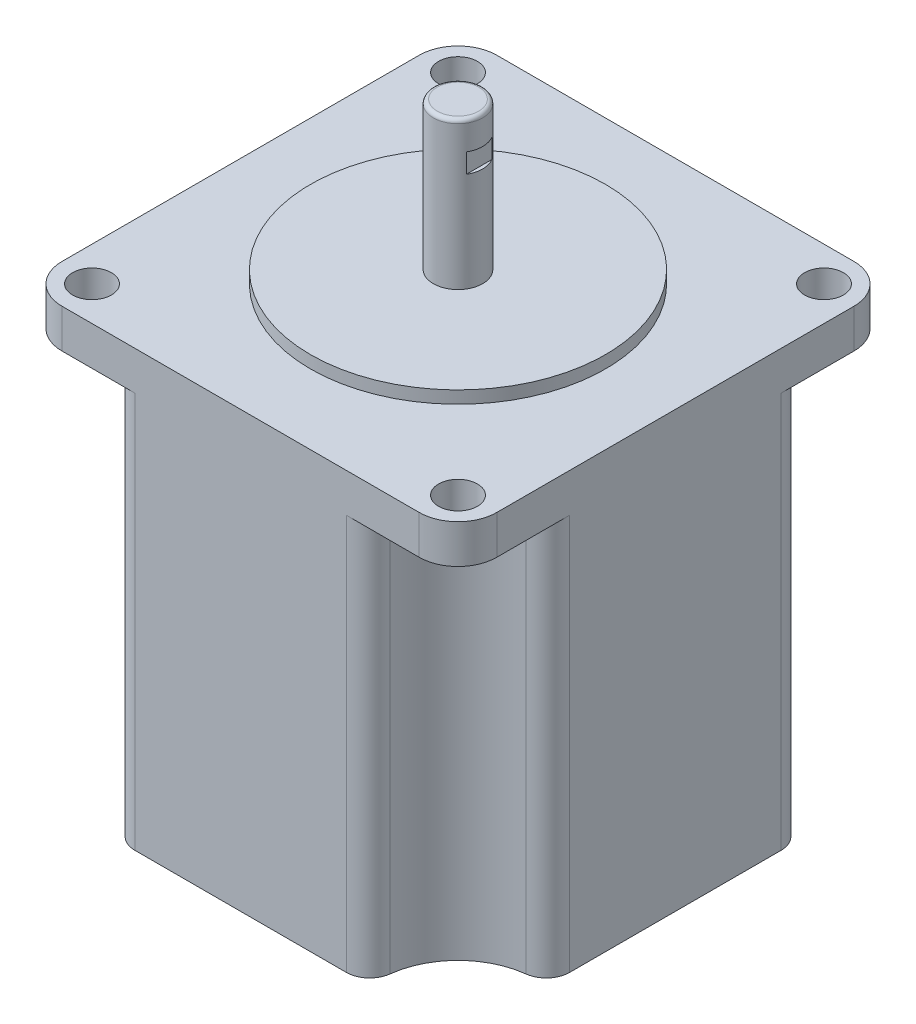
from build123d import *

# Parameters (mm, degrees)
EXTRUDE1_DEPTH      = 56
SKETCH2_R           = 2.5
EXTRUDE2_DEPTH      = 69.585712798
SKETCH4_R           = 10
EXTRUDE3_DEPTH      = 51
FILLET1_R           = 3
SKETCH5_R           = 19
EXTRUDE4_DEPTH      = 1.6
SKETCH6_R           = 3.175
EXTRUDE5_DEPTH      = 20.6
FILLET2_R           = 0.5
SKETCH_1_W          = 0.754278007
SKETCH_1_H          = 3.431599036
CUT_EXTRUDE_1_DEPTH = 2.5


with BuildPart() as part:
    # Sketch1 → Extrude1 (new body)
    with BuildSketch(Plane(origin=(0, 0, 0), x_dir=(1, 0, 0), z_dir=(0, 1, 0))):
        with BuildLine():
            Line((-23, 28), (23, 28))
            ThreePointArc((23, 28), (26.535533906, 26.535533906), (28, 23))
            Line((28, 23), (28, -23))
            ThreePointArc((28, -23), (26.535533906, -26.535533906), (23, -28))
            Line((23, -28), (-23, -28))
            ThreePointArc((-23, -28), (-26.535533906, -26.535533906), (-28, -23))
            Line((-28, -23), (-28, 23))
            ThreePointArc((-28, 23), (-26.535533906, 26.535533906), (-23, 28))
        make_face()
    extrude(amount=EXTRUDE1_DEPTH)

    # Sketch2 → Extrude2 (cut, through all)
    with BuildSketch(Plane.XZ):
        with Locations(Location((23.57, 23.57, 0), (0, 0, 90))):
            Circle(SKETCH2_R)
        with Locations(Location((23.57, -23.57, 0), (0, 0, 270))):
            Circle(SKETCH2_R)
        with Locations(Location((-23.57, -23.57, 0), (0, 0, 90))):
            Circle(SKETCH2_R)
        with Locations(Location((-23.57, 23.57, 0), (0, 0, 270))):
            Circle(SKETCH2_R)
    extrude(amount=-EXTRUDE2_DEPTH, mode=Mode.SUBTRACT)

    # Sketch4 → Extrude3 (cut)
    with BuildSketch(Plane.XZ):
        with Locations((-26.535533906, 26.535533906)):
            Circle(SKETCH4_R)
        with Locations((26.535533906, 26.535533906)):
            Circle(SKETCH4_R)
        with Locations((26.535533906, -26.535533906)):
            Circle(SKETCH4_R)
        with Locations((-26.535533906, -26.535533906)):
            Circle(SKETCH4_R)
    extrude(amount=-EXTRUDE3_DEPTH, mode=Mode.SUBTRACT)

    # Fillet1
    fillet1_edges = [part.edges().sort_by_distance(p)[0] for p in [
        (-28, 25.5, 16.643348149),
        (-16.643348149, 25.5, 28),
        (16.643348149, 25.5, 28),
        (28, 25.5, 16.643348149),
        (28, 25.5, -16.643348149),
        (16.643348149, 25.5, -28),
        (-28, 25.5, -16.643348149),
        (-16.643348149, 25.5, -28),
    ]]
    fillet(fillet1_edges, radius=FILLET1_R)

    # Sketch5 → Extrude4 (add)
    with BuildSketch(Plane(origin=(0, 56, 0), x_dir=(1, 0, 0), z_dir=(0, 1, 0))):
        with Locations(Location((0, 0, 0), (0, 0, 90))):
            Circle(SKETCH5_R)
    extrude(amount=EXTRUDE4_DEPTH)

    # Sketch6 → Extrude5 (add)
    with BuildSketch(Plane(origin=(0, 56, 0), x_dir=(1, 0, 0), z_dir=(0, 1, 0))):
        with Locations(Location((0, 0, 0), (0, 0, 90))):
            Circle(SKETCH6_R)
    extrude(amount=EXTRUDE5_DEPTH)

    # Fillet2
    fillet2_edges = [part.edges().sort_by_distance(p)[0] for p in [
        (0, 76.6, 3.175),
    ]]
    fillet(fillet2_edges, radius=FILLET2_R)

    # Эскиз1 → Вытянуть1 (cut)
    with BuildSketch(Plane(origin=(0, 70.4, 0), x_dir=(-1, 0, 0), z_dir=(0, 1, 0))):
        with Locations((3.096320075, 0.076690216)):
            Rectangle(SKETCH_1_W, SKETCH_1_H)
        with Locations((-3.096320075, 0.076690216)):
            Rectangle(SKETCH_1_W, SKETCH_1_H)
    extrude(amount=CUT_EXTRUDE_1_DEPTH, mode=Mode.SUBTRACT)


solid = part.part
